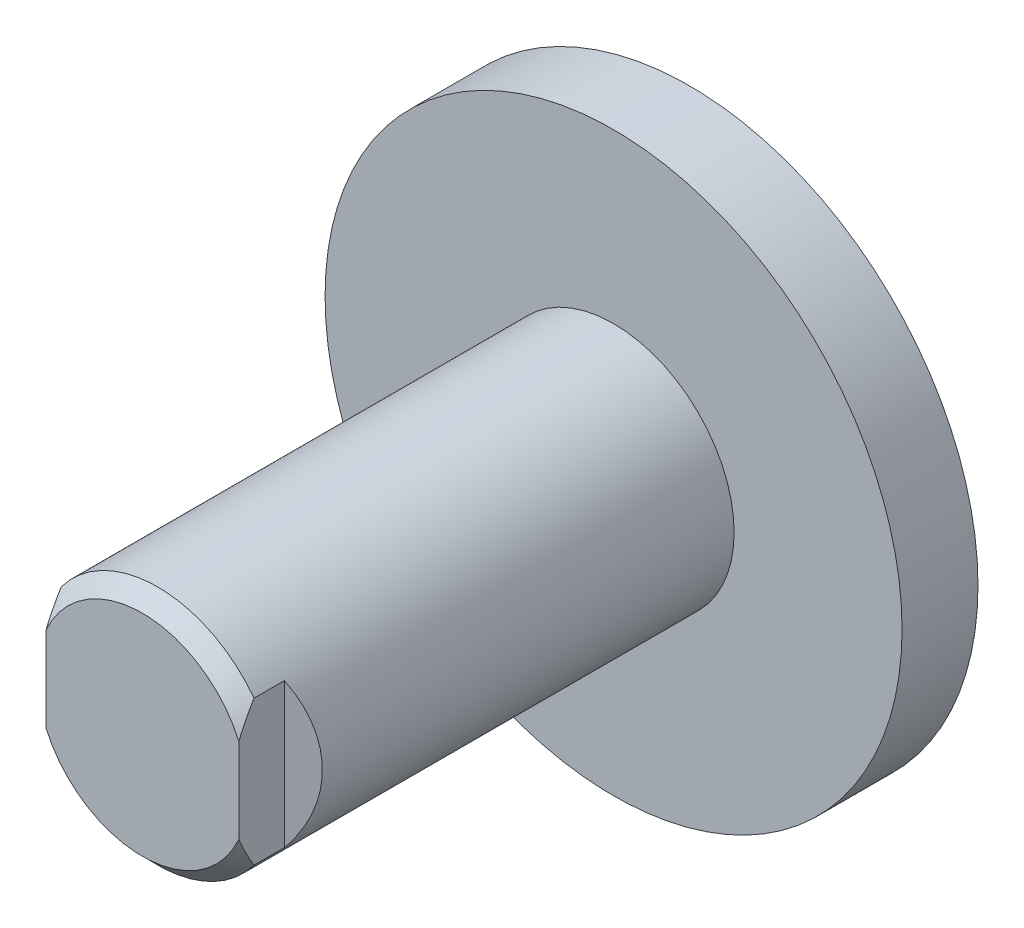
from build123d import *

# Parameters (mm, degrees)
SKETCH1_R               = 19
PISTON_DEPTH            = 5
SKETCH2_R               = 7.9375
ROD_DEPTH               = 36.028
ROD_END_CHAMFER_SIZE    = 1
WRENCH_FLATS_DEPTH      = 45.944596828
WRENCH_FLATS_DEPTH_BACK = 45.944596828


with BuildPart() as part:
    # Sketch1 → Piston (new body)
    with BuildSketch(Plane.XY):
        Circle(SKETCH1_R)
    extrude(amount=PISTON_DEPTH)

    # Sketch2 → Rod (add)
    with BuildSketch(Plane(origin=(0, 0, 0), x_dir=(-1, 0, 0), z_dir=(0, 0, -1))):
        Circle(SKETCH2_R)
    extrude(amount=-ROD_DEPTH)

    # Rod End Chamfer
    rod_end_chamfer_edges = [part.edges().sort_by_distance(p)[0] for p in [
        (7.9375, 0, 36.028),
    ]]
    chamfer(rod_end_chamfer_edges, length=ROD_END_CHAMFER_SIZE)

    # Sketch11 → Wrench Flats (cut, two sides: drawn at the far end of the back side and taken through both)
    with BuildSketch(Plane(origin=(0, 0, 0), x_dir=(1, 0, 0), z_dir=(0, 1, 0)).offset(-WRENCH_FLATS_DEPTH_BACK)):
        Polygon((-6.35, -36.028), (-6.35, -33.028), (-11.35, -30.141248654), (-11.35, -36.028), align=None)
        Polygon((6.35, -36.028), (6.35, -33.028), (11.35, -30.141248654), (11.35, -36.028), align=None)
    extrude(amount=WRENCH_FLATS_DEPTH + WRENCH_FLATS_DEPTH_BACK, mode=Mode.SUBTRACT)


solid = part.part
